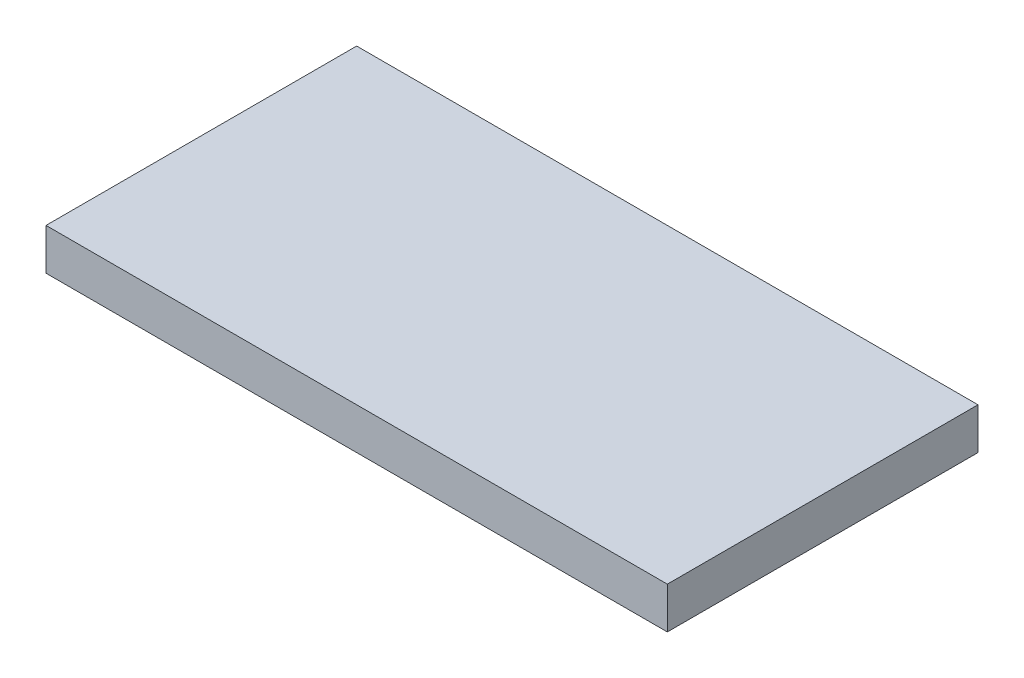
from build123d import *

# Parameters (mm, degrees)
SKETCH1_W                = 192
SKETCH1_H                = 96
BOSS_EXTRUDE1_DEPTH      = 12.8
SKETCH2_W                = 167
SKETCH2_H                = 71
CUT_EXTRUDE1_DEPTH       = 9.2
M3_CLEARANCE_HOLE1_D     = 3.4
M3_CLEARANCE_HOLE1_DEPTH = 5
M3_CLEARANCE_HOLE1_TIP   = 1.021463052
SKETCH6_W                = 8.6
SKETCH6_H                = 27.8
BOSS_EXTRUDE2_DEPTH      = 9.6
SKETCH7_W                = 15.9
SKETCH7_H                = 7.6
BOSS_EXTRUDE3_DEPTH      = 11.2


with BuildPart() as part:
    # Sketch1 → Boss-Extrude1 (new body)
    with BuildSketch(Plane(origin=(0, 0, 0), x_dir=(1, 0, 0), z_dir=(0, 1, 0))):
        with Locations((96, 48)):
            Rectangle(SKETCH1_W, SKETCH1_H)
    extrude(amount=BOSS_EXTRUDE1_DEPTH)

    # Sketch2 → Cut-Extrude1 (cut)
    with BuildSketch(Plane.XZ):
        with Locations((96, -48)):
            Rectangle(SKETCH2_W, SKETCH2_H)
    extrude(amount=-CUT_EXTRUDE1_DEPTH, mode=Mode.SUBTRACT)

    # M3 Clearance Hole1
    with Locations(Plane(origin=(0, 0, 0), x_dir=(-1, 0, 0), z_dir=(0, -1, 0))):
        with Locations((-13, 9.1), (-96, 9.1), (-179, 9.1), (-179, 86.9), (-96, 86.9), (-13, 86.9)):
            Hole(M3_CLEARANCE_HOLE1_D / 2, depth=M3_CLEARANCE_HOLE1_DEPTH)
            with Locations((0, 0, -(M3_CLEARANCE_HOLE1_DEPTH + M3_CLEARANCE_HOLE1_TIP / 2))):  # 118° drill point
                Cone(0, M3_CLEARANCE_HOLE1_D / 2, M3_CLEARANCE_HOLE1_TIP, mode=Mode.SUBTRACT)

    # Sketch6 → Boss-Extrude2 (add)
    with BuildSketch(Plane.XZ.offset(-9.2)):
        with Locations((20.8, -47.8)):
            Rectangle(SKETCH6_W, SKETCH6_H)
        with Locations((171.2, -47.8)):
            Rectangle(SKETCH6_W, SKETCH6_H)
    extrude(amount=BOSS_EXTRUDE2_DEPTH)

    # Sketch7 → Boss-Extrude3 (add)
    with BuildSketch(Plane.XZ.offset(-9.2)):
        with Locations((114.05, -43.1)):
            Rectangle(SKETCH7_W, SKETCH7_H)
    extrude(amount=BOSS_EXTRUDE3_DEPTH)


solid = part.part
